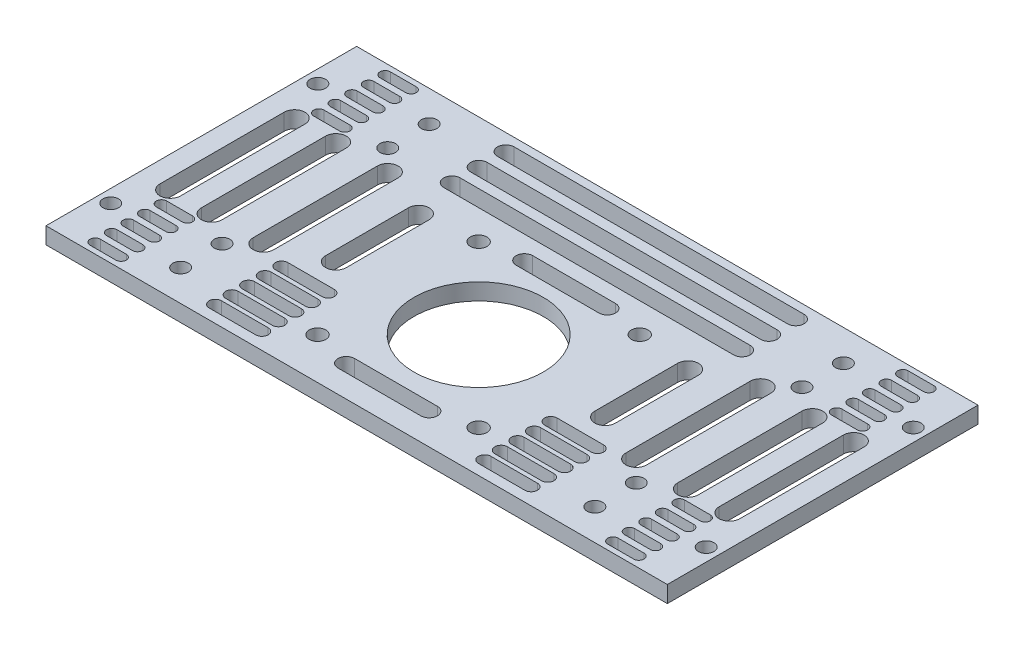
from build123d import *

# Parameters (mm, degrees)
SKETCH_1_W          = 120
SKETCH_1_H          = 60
EXTRUDE_1_DEPTH     = 3.2
SKETCH_2_R          = 12.5
SKETCH_2_R_2        = 1.6
SKETCH_2_R_3        = 1.5
CUT_EXTRUDE_1_DEPTH = 3.2
CUT_EXTRUDE_2_DEPTH = 3.2


with BuildPart() as part:
    # 草图1 → 凸台-拉伸1 (new body)
    with BuildSketch(Plane(origin=(0, 0, 0), x_dir=(1, 0, 0), z_dir=(0, 1, 0))):
        Rectangle(SKETCH_1_W, SKETCH_1_H)
    extrude(amount=EXTRUDE_1_DEPTH)

    # 草图2 → 切除-拉伸1 (cut)
    with BuildSketch(Plane(origin=(0, 3.2, 0), x_dir=(1, 0, 0), z_dir=(0, 1, 0))):
        with Locations(Location((0, -6.443650814, 0), (0, 0, 270))):
            Circle(SKETCH_2_R)
        with Locations(Location((15.556349186, -22, 0), (0, 0, 270))):
            Circle(SKETCH_2_R_2)
        with Locations(Location((15.556349186, 9.112698372, 0), (0, 0, 270))):
            Circle(SKETCH_2_R_2)
        with Locations(Location((-15.556349186, 9.112698372, 0), (0, 0, 270))):
            Circle(SKETCH_2_R_2)
        with Locations(Location((-15.556349186, -22, 0), (0, 0, 270))):
            Circle(SKETCH_2_R_2)
        with Locations(Location((-57.5, 20, 0), (0, 0, 270))):
            Circle(SKETCH_2_R_3)
        with Locations(Location((-57.5, -20, 0), (0, 0, 270))):
            Circle(SKETCH_2_R_3)
        with Locations(Location((57.5, -20, 0), (0, 0, 270))):
            Circle(SKETCH_2_R_3)
        with Locations(Location((57.5, 20, 0), (0, 0, 270))):
            Circle(SKETCH_2_R_3)
        with Locations(Location((-40, -24, 0), (0, 0, 270))):
            Circle(SKETCH_2_R_3)
        with Locations(Location((-40, -16, 0), (0, 0, 270))):
            Circle(SKETCH_2_R_3)
        with Locations(Location((-40, 24, 0), (0, 0, 270))):
            Circle(SKETCH_2_R_3)
        with Locations(Location((-40, 16, 0), (0, 0, 270))):
            Circle(SKETCH_2_R_3)
        with Locations(Location((40, -24, 0), (0, 0, 270))):
            Circle(SKETCH_2_R_3)
        with Locations(Location((40, -16, 0), (0, 0, 270))):
            Circle(SKETCH_2_R_3)
        with Locations(Location((40, 24, 0), (0, 0, 270))):
            Circle(SKETCH_2_R_3)
        with Locations(Location((40, 16, 0), (0, 0, 270))):
            Circle(SKETCH_2_R_3)
    extrude(amount=-CUT_EXTRUDE_1_DEPTH, mode=Mode.SUBTRACT)

    # 草图3 → 切除-拉伸2 (cut)
    with BuildSketch(Plane(origin=(0, 3.2, 0), x_dir=(1, 0, 0), z_dir=(0, 1, 0))):
        with BuildLine():
            Line((-28, 28.4), (28, 28.4))
            ThreePointArc((28, 28.4), (29.6, 26.8), (28, 25.2))
            Line((28, 25.2), (-28, 25.2))
            ThreePointArc((-28, 25.2), (-29.6, 26.8), (-28, 28.4))
        make_face()
        with BuildLine():
            Line((-28, 23.2), (28, 23.2))
            ThreePointArc((28, 23.2), (29.6, 21.6), (28, 20))
            Line((28, 20), (-28, 20))
            ThreePointArc((-28, 20), (-29.6, 21.6), (-28, 23.2))
        make_face()
        with BuildLine():
            Line((-28, 18), (28, 18))
            ThreePointArc((28, 18), (29.6, 16.4), (28, 14.8))
            Line((28, 14.8), (-28, 14.8))
            ThreePointArc((-28, 14.8), (-29.6, 16.4), (-28, 18))
        make_face()
        with BuildLine():
            Line((-8, 12), (8, 12))
            ThreePointArc((8, 12), (9.6, 10.4), (8, 8.8))
            Line((8, 8.8), (-8, 8.8))
            ThreePointArc((-8, 8.8), (-9.6, 10.4), (-8, 12))
        make_face()
        with BuildLine():
            Line((-8, -22.4), (8, -22.4))
            ThreePointArc((8, -22.4), (9.6, -24), (8, -25.6))
            Line((8, -25.6), (-8, -25.6))
            ThreePointArc((-8, -25.6), (-9.6, -24), (-8, -22.4))
        make_face()
        with BuildLine():
            Line((-52, 12), (-52, -12))
            ThreePointArc((-52, -12), (-54, -14), (-56, -12))
            Line((-56, -12), (-56, 12))
            ThreePointArc((-56, 12), (-54, 14), (-52, 12))
        make_face()
        with BuildLine():
            Line((-44, 12), (-44, -12))
            ThreePointArc((-44, -12), (-46, -14), (-48, -12))
            Line((-48, -12), (-48, 12))
            ThreePointArc((-48, 12), (-46, 14), (-44, 12))
        make_face()
        with BuildLine():
            Line((-34, 12), (-34, -12))
            ThreePointArc((-34, -12), (-36, -14), (-38, -12))
            Line((-38, -12), (-38, 12))
            ThreePointArc((-38, 12), (-36, 14), (-34, 12))
        make_face()
        with BuildLine():
            Line((-24, 8), (-24, -8))
            ThreePointArc((-24, -8), (-26, -10), (-28, -8))
            Line((-28, -8), (-28, 8))
            ThreePointArc((-28, 8), (-26, 10), (-24, 8))
        make_face()
        with BuildLine():
            Line((52, 12), (52, -12))
            ThreePointArc((52, -12), (54, -14), (56, -12))
            Line((56, -12), (56, 12))
            ThreePointArc((56, 12), (54, 14), (52, 12))
        make_face()
        with BuildLine():
            Line((44, 12), (44, -12))
            ThreePointArc((44, -12), (46, -14), (48, -12))
            Line((48, -12), (48, 12))
            ThreePointArc((48, 12), (46, 14), (44, 12))
        make_face()
        with BuildLine():
            Line((34, 12), (34, -12))
            ThreePointArc((34, -12), (36, -14), (38, -12))
            Line((38, -12), (38, 12))
            ThreePointArc((38, 12), (36, 14), (34, 12))
        make_face()
        with BuildLine():
            Line((24, 8), (24, -8))
            ThreePointArc((24, -8), (26, -10), (28, -8))
            Line((28, -8), (28, 8))
            ThreePointArc((28, 8), (26, 10), (24, 8))
        make_face()
        with BuildLine():
            Line((-30.5, -16), (-21.5, -16))
            ThreePointArc((-21.5, -16), (-20.3, -17.2), (-21.5, -18.4))
            Line((-21.5, -18.4), (-30.5, -18.4))
            ThreePointArc((-30.5, -18.4), (-31.7, -17.2), (-30.5, -16))
        make_face()
        with BuildLine():
            Line((-30.5, -19.2), (-21.5, -19.2))
            ThreePointArc((-21.5, -19.2), (-20.3, -20.4), (-21.5, -21.6))
            Line((-21.5, -21.6), (-30.5, -21.6))
            ThreePointArc((-30.5, -21.6), (-31.7, -20.4), (-30.5, -19.2))
        make_face()
        with BuildLine():
            Line((-30.5, -22.4), (-21.5, -22.4))
            ThreePointArc((-21.5, -22.4), (-20.3, -23.6), (-21.5, -24.8))
            Line((-21.5, -24.8), (-30.5, -24.8))
            ThreePointArc((-30.5, -24.8), (-31.7, -23.6), (-30.5, -22.4))
        make_face()
        with BuildLine():
            Line((-30.5, -25.6), (-21.5, -25.6))
            ThreePointArc((-21.5, -25.6), (-20.3, -26.8), (-21.5, -28))
            Line((-21.5, -28), (-30.5, -28))
            ThreePointArc((-30.5, -28), (-31.7, -26.8), (-30.5, -25.6))
        make_face()
        with BuildLine():
            Line((-52.5, -23.8), (-47.5, -23.8))
            ThreePointArc((-47.5, -23.8), (-46.5, -24.8), (-47.5, -25.8))
            Line((-47.5, -25.8), (-52.5, -25.8))
            ThreePointArc((-52.5, -25.8), (-53.5, -24.8), (-52.5, -23.8))
        make_face()
        with BuildLine():
            Line((-52.5, -27), (-47.5, -27))
            ThreePointArc((-47.5, -27), (-46.5, -28), (-47.5, -29))
            Line((-47.5, -29), (-52.5, -29))
            ThreePointArc((-52.5, -29), (-53.5, -28), (-52.5, -27))
        make_face()
        with BuildLine():
            Line((-52.5, -17.4), (-47.5, -17.4))
            ThreePointArc((-47.5, -17.4), (-46.5, -18.4), (-47.5, -19.4))
            Line((-47.5, -19.4), (-52.5, -19.4))
            ThreePointArc((-52.5, -19.4), (-53.5, -18.4), (-52.5, -17.4))
        make_face()
        with BuildLine():
            Line((-30.5, -12.8), (-21.5, -12.8))
            ThreePointArc((-21.5, -12.8), (-20.3, -14), (-21.5, -15.2))
            Line((-21.5, -15.2), (-30.5, -15.2))
            ThreePointArc((-30.5, -15.2), (-31.7, -14), (-30.5, -12.8))
        make_face()
        with BuildLine():
            Line((-52.5, -20.6), (-47.5, -20.6))
            ThreePointArc((-47.5, -20.6), (-46.5, -21.6), (-47.5, -22.6))
            Line((-47.5, -22.6), (-52.5, -22.6))
            ThreePointArc((-52.5, -22.6), (-53.5, -21.6), (-52.5, -20.6))
        make_face()
        with BuildLine():
            Line((-52.5, -14.2), (-47.5, -14.2))
            ThreePointArc((-47.5, -14.2), (-46.5, -15.2), (-47.5, -16.2))
            Line((-47.5, -16.2), (-52.5, -16.2))
            ThreePointArc((-52.5, -16.2), (-53.5, -15.2), (-52.5, -14.2))
        make_face()
        with BuildLine():
            Line((52.5, -14.2), (47.5, -14.2))
            ThreePointArc((47.5, -14.2), (46.5, -15.2), (47.5, -16.2))
            Line((47.5, -16.2), (52.5, -16.2))
            ThreePointArc((52.5, -16.2), (53.5, -15.2), (52.5, -14.2))
        make_face()
        with BuildLine():
            Line((52.5, -17.4), (47.5, -17.4))
            ThreePointArc((47.5, -17.4), (46.5, -18.4), (47.5, -19.4))
            Line((47.5, -19.4), (52.5, -19.4))
            ThreePointArc((52.5, -19.4), (53.5, -18.4), (52.5, -17.4))
        make_face()
        with BuildLine():
            Line((52.5, -20.6), (47.5, -20.6))
            ThreePointArc((47.5, -20.6), (46.5, -21.6), (47.5, -22.6))
            Line((47.5, -22.6), (52.5, -22.6))
            ThreePointArc((52.5, -22.6), (53.5, -21.6), (52.5, -20.6))
        make_face()
        with BuildLine():
            Line((52.5, -23.8), (47.5, -23.8))
            ThreePointArc((47.5, -23.8), (46.5, -24.8), (47.5, -25.8))
            Line((47.5, -25.8), (52.5, -25.8))
            ThreePointArc((52.5, -25.8), (53.5, -24.8), (52.5, -23.8))
        make_face()
        with BuildLine():
            Line((52.5, -27), (47.5, -27))
            ThreePointArc((47.5, -27), (46.5, -28), (47.5, -29))
            Line((47.5, -29), (52.5, -29))
            ThreePointArc((52.5, -29), (53.5, -28), (52.5, -27))
        make_face()
        with BuildLine():
            Line((30.5, -25.6), (21.5, -25.6))
            ThreePointArc((21.5, -25.6), (20.3, -26.8), (21.5, -28))
            Line((21.5, -28), (30.5, -28))
            ThreePointArc((30.5, -28), (31.7, -26.8), (30.5, -25.6))
        make_face()
        with BuildLine():
            Line((30.5, -22.4), (21.5, -22.4))
            ThreePointArc((21.5, -22.4), (20.3, -23.6), (21.5, -24.8))
            Line((21.5, -24.8), (30.5, -24.8))
            ThreePointArc((30.5, -24.8), (31.7, -23.6), (30.5, -22.4))
        make_face()
        with BuildLine():
            Line((30.5, -19.2), (21.5, -19.2))
            ThreePointArc((21.5, -19.2), (20.3, -20.4), (21.5, -21.6))
            Line((21.5, -21.6), (30.5, -21.6))
            ThreePointArc((30.5, -21.6), (31.7, -20.4), (30.5, -19.2))
        make_face()
        with BuildLine():
            Line((30.5, -16), (21.5, -16))
            ThreePointArc((21.5, -16), (20.3, -17.2), (21.5, -18.4))
            Line((21.5, -18.4), (30.5, -18.4))
            ThreePointArc((30.5, -18.4), (31.7, -17.2), (30.5, -16))
        make_face()
        with BuildLine():
            Line((30.5, -12.8), (21.5, -12.8))
            ThreePointArc((21.5, -12.8), (20.3, -14), (21.5, -15.2))
            Line((21.5, -15.2), (30.5, -15.2))
            ThreePointArc((30.5, -15.2), (31.7, -14), (30.5, -12.8))
        make_face()
        with BuildLine():
            Line((-52.5, 14.2), (-47.5, 14.2))
            ThreePointArc((-47.5, 14.2), (-46.5, 15.2), (-47.5, 16.2))
            Line((-47.5, 16.2), (-52.5, 16.2))
            ThreePointArc((-52.5, 16.2), (-53.5, 15.2), (-52.5, 14.2))
        make_face()
        with BuildLine():
            Line((-52.5, 17.4), (-47.5, 17.4))
            ThreePointArc((-47.5, 17.4), (-46.5, 18.4), (-47.5, 19.4))
            Line((-47.5, 19.4), (-52.5, 19.4))
            ThreePointArc((-52.5, 19.4), (-53.5, 18.4), (-52.5, 17.4))
        make_face()
        with BuildLine():
            Line((-52.5, 20.6), (-47.5, 20.6))
            ThreePointArc((-47.5, 20.6), (-46.5, 21.6), (-47.5, 22.6))
            Line((-47.5, 22.6), (-52.5, 22.6))
            ThreePointArc((-52.5, 22.6), (-53.5, 21.6), (-52.5, 20.6))
        make_face()
        with BuildLine():
            Line((-52.5, 23.8), (-47.5, 23.8))
            ThreePointArc((-47.5, 23.8), (-46.5, 24.8), (-47.5, 25.8))
            Line((-47.5, 25.8), (-52.5, 25.8))
            ThreePointArc((-52.5, 25.8), (-53.5, 24.8), (-52.5, 23.8))
        make_face()
        with BuildLine():
            Line((-52.5, 27), (-47.5, 27))
            ThreePointArc((-47.5, 27), (-46.5, 28), (-47.5, 29))
            Line((-47.5, 29), (-52.5, 29))
            ThreePointArc((-52.5, 29), (-53.5, 28), (-52.5, 27))
        make_face()
        with BuildLine():
            Line((52.5, 14.2), (47.5, 14.2))
            ThreePointArc((47.5, 14.2), (46.5, 15.2), (47.5, 16.2))
            Line((47.5, 16.2), (52.5, 16.2))
            ThreePointArc((52.5, 16.2), (53.5, 15.2), (52.5, 14.2))
        make_face()
        with BuildLine():
            Line((52.5, 17.4), (47.5, 17.4))
            ThreePointArc((47.5, 17.4), (46.5, 18.4), (47.5, 19.4))
            Line((47.5, 19.4), (52.5, 19.4))
            ThreePointArc((52.5, 19.4), (53.5, 18.4), (52.5, 17.4))
        make_face()
        with BuildLine():
            Line((52.5, 20.6), (47.5, 20.6))
            ThreePointArc((47.5, 20.6), (46.5, 21.6), (47.5, 22.6))
            Line((47.5, 22.6), (52.5, 22.6))
            ThreePointArc((52.5, 22.6), (53.5, 21.6), (52.5, 20.6))
        make_face()
        with BuildLine():
            Line((52.5, 23.8), (47.5, 23.8))
            ThreePointArc((47.5, 23.8), (46.5, 24.8), (47.5, 25.8))
            Line((47.5, 25.8), (52.5, 25.8))
            ThreePointArc((52.5, 25.8), (53.5, 24.8), (52.5, 23.8))
        make_face()
        with BuildLine():
            Line((52.5, 27), (47.5, 27))
            ThreePointArc((47.5, 27), (46.5, 28), (47.5, 29))
            Line((47.5, 29), (52.5, 29))
            ThreePointArc((52.5, 29), (53.5, 28), (52.5, 27))
        make_face()
    extrude(amount=-CUT_EXTRUDE_2_DEPTH, mode=Mode.SUBTRACT)


solid = part.part
